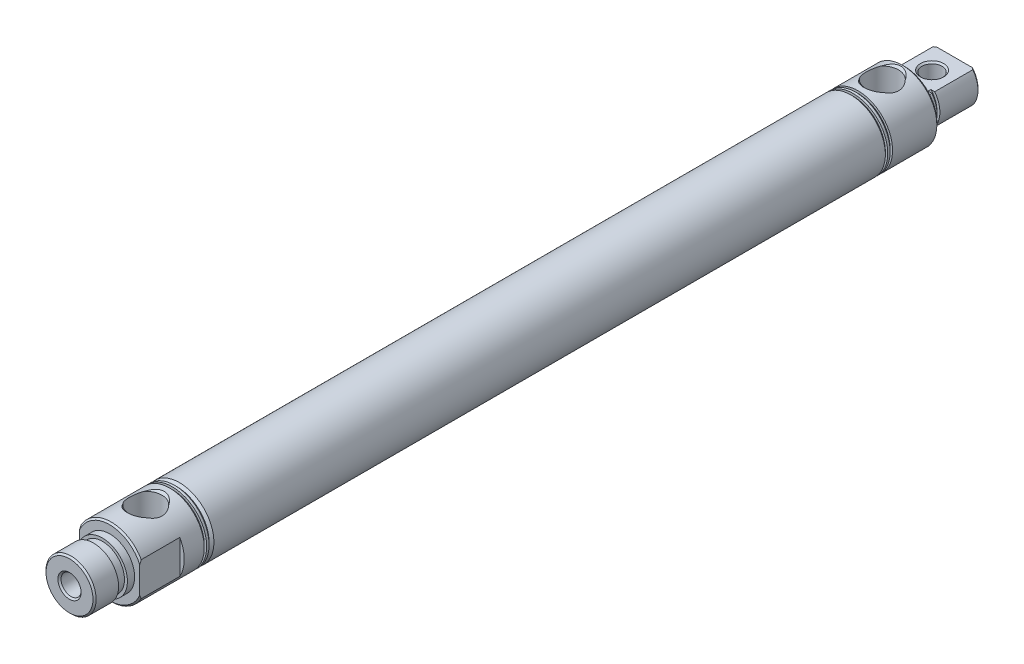
from build123d import *

# Parameters (mm, degrees)
EXTRUDE1_DEPTH      = 133.731
EXTRUDE1_DEPTH_BACK = 133.731
SKETCH1_R           = 10.922
SKETCH3_W           = 0.762
SKETCH3_H           = 0.762
RODHOLE_START       = -237.831
SKETCH8_R           = 3.175
RODHOLE_DEPTH       = 237.831
SKETCH9_R           = 9.525
STROKECHAMBER_DEPTH = 182.8
CHAMFER1_SIZE       = 0.5
FLATS_DEPTH         = 148.243396909
FLATS_DEPTH_BACK    = 148.243396909
SKETCH4_W           = 1.397
SKETCH4_H           = 12.7
SKETCH4_W_2         = 0.5
SKETCH4_H_2         = 3.048
ENDFLATS_DEPTH      = 148.243396909
ENDFLATS_DEPTH_BACK = 148.243396909
SKETCH12_W          = 6.096
SKETCH12_H          = 15.024


with BuildPart() as part:
    # Sketch1 → Extrude1 (new, two sides: drawn at the far end of the back side and taken through both)
    with BuildSketch(Plane.XY.offset(-EXTRUDE1_DEPTH_BACK)):
        Circle(SKETCH1_R)
    extrude(amount=EXTRUDE1_DEPTH + EXTRUDE1_DEPTH_BACK)

    # Sketch2 → Nose (revolve)
    with BuildSketch(Plane(origin=(0, 0, 0), x_dir=(0, 0, -1), z_dir=(1, 0, 0)), mode=Mode.PRIVATE) as nose_sk:
        Polygon((-133.731, 7.9248), (-136.017, 7.9248), (-136.017, 7), (-138.817, 7), (-138.817, 7.9375), (-146.431, 7.9375), (-146.431, 0), (-133.731, 0), align=None)
    revolve(nose_sk.sketch.rotate(Axis((0, 0, 0), (0, 0, 1)), 90), axis=Axis((0, 0, 0), (0, 0, 1)))

    # Sketch3 → CoverGrooves (revolve, cut)
    with BuildSketch(Plane(origin=(0, 0, 0), x_dir=(0, 0, -1), z_dir=(1, 0, 0)), mode=Mode.PRIVATE) as covergrooves_sk:
        with Locations((-114.3, 10.541)):
            Rectangle(SKETCH3_W, SKETCH3_H)
        Polygon((-113.157, 10.922), (-113.157, 10.16), (-112.395, 10.16), (-111.633, 10.922), align=None)
        Polygon((103.207, 10.922), (103.207, 10.16), (102.445, 10.922), align=None)
        Polygon((101.683, 10.922), (101.683, 10.16), (100.921, 10.922), align=None)
    revolve(covergrooves_sk.sketch.rotate(Axis((0, 0, 0), (0, 0, 1)), 90), axis=Axis((0, 0, 0), (0, 0, 1)), mode=Mode.SUBTRACT)

    # Sketch7 → FrontPort (revolve, cut)
    with BuildSketch(Plane(origin=(0, 0, 0), x_dir=(0, 0, -1), z_dir=(1, 0, 0))):
        Polygon((-122.301, 10.922), (-116.451, 10.922), (-117.151, 10.222), (-117.151, 0), (-122.301, 0), align=None)
    revolve(axis=Axis((0, 0, 122.301), (0, 1, 0)), mode=Mode.SUBTRACT)

    # Sketch8 → RodHole (cut)
    with BuildSketch(Plane.XY.offset(146.431).offset(RODHOLE_START)):
        Circle(SKETCH8_R)
    extrude(amount=RODHOLE_DEPTH, mode=Mode.SUBTRACT)

    # Sketch9 → StrokeChamber (cut)
    with BuildSketch(Plane.XY.offset(-91.4)):
        Circle(SKETCH9_R)
    extrude(amount=STROKECHAMBER_DEPTH, mode=Mode.SUBTRACT)

    # Chamfer1
    chamfer1_edges = [part.edges().sort_by_distance(p)[0] for p in [
        (-10.922, 0, -133.731),
        (-3.175, 0, 146.431),
        (-10.922, 0, 133.731),
        (7.9375, 0, 146.431),
    ]]
    chamfer(chamfer1_edges, length=CHAMFER1_SIZE)

    # Sketch4 → Flats (cut, two sides: drawn at the far end of the back side and taken through both)
    with BuildSketch(Plane(origin=(0, 0, 0), x_dir=(1, 0, 0), z_dir=(0, 1, 0)).offset(-FLATS_DEPTH_BACK)):
        with Locations((10.2235, -127.381)):
            Rectangle(SKETCH4_W, SKETCH4_H)
        with Locations((10.672, 132.207)):
            Rectangle(SKETCH4_W_2, SKETCH4_H_2)
        with Locations((-10.672, 132.207)):
            Rectangle(SKETCH4_W_2, SKETCH4_H_2)
        with Locations((-10.2235, -127.381)):
            Rectangle(SKETCH4_W, SKETCH4_H)
    extrude(amount=FLATS_DEPTH + FLATS_DEPTH_BACK, mode=Mode.SUBTRACT)

    # Sketch11 → EndThreads (revolve, cut)
    with BuildSketch(Plane(origin=(0, 0, 0), x_dir=(0, 0, -1), z_dir=(1, 0, 0)), mode=Mode.PRIVATE) as endthreads_sk:
        Polygon((133.731, 7.4375), (133.231, 7.9375), (121.17, 7.9375), (121.17, 7), (120.269, 7), (120.269, 7.9375), (117.983, 7.9375), (117.983, 10.16), (117.221, 10.922), (133.731, 10.922), align=None)
    revolve(endthreads_sk.sketch.rotate(Axis((0, 0, 0), (0, 0, -1)), 90), axis=Axis((0, 0, 0), (0, 0, -1)), mode=Mode.SUBTRACT)

    # Sketch13 → RearTopPort (revolve, cut)
    with BuildSketch(Plane(origin=(0, 0, 0), x_dir=(0, 0, -1), z_dir=(1, 0, 0))):
        Polygon((110.871, 0), (116.021, 0), (116.021, 10.222), (116.721, 10.922), (110.871, 10.922), align=None)
    revolve(axis=Axis((0, 0, -110.871), (0, 1, 0)), mode=Mode.SUBTRACT)

    # Sketch12 → EndFlats (cut, two sides: drawn at the far end of the back side and taken through both)
    with BuildSketch(Plane(origin=(0, 0, 0), x_dir=(0, -1, 0), z_dir=(1, 0, 0)).offset(-ENDFLATS_DEPTH_BACK)):
        with Locations((7.874, 126.219)):
            Rectangle(SKETCH12_W, SKETCH12_H)
        with Locations((-7.874, 126.219)):
            Rectangle(SKETCH12_W, SKETCH12_H)
    extrude(amount=ENDFLATS_DEPTH + ENDFLATS_DEPTH_BACK, mode=Mode.SUBTRACT)

    # Sketch15 → ClevisPinHole (revolve, cut)
    with BuildSketch(Plane(origin=(0, 0, 0), x_dir=(0, -1, 0), z_dir=(1, 0, 0)), mode=Mode.PRIVATE) as clevispinhole_sk:
        Polygon((4.826, 130.3067), (4.326, 129.8067), (-4.326, 129.8067), (-4.826, 130.3067), (-4.826, 126.619), (4.826, 126.619), align=None)
    revolve(clevispinhole_sk.sketch.rotate(Axis((0, 0, -126.619), (0, -1, 0)), 180), axis=Axis((0, 0, -126.619), (0, -1, 0)), mode=Mode.SUBTRACT)


solid = part.part
